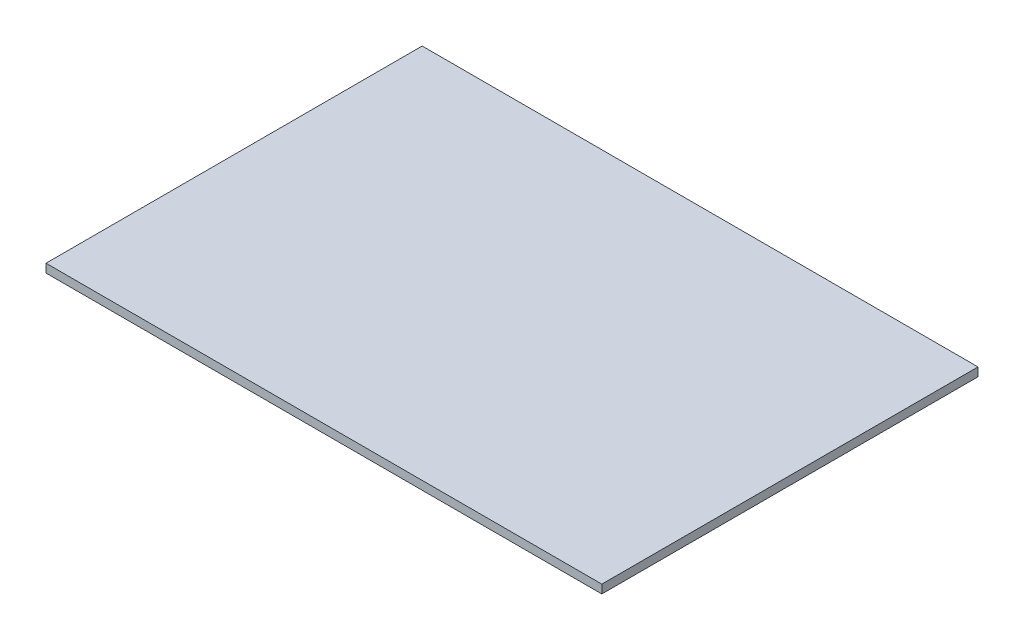
from build123d import *

# Parameters (mm, degrees)
SKETCH1_W           = 154.689230834
SKETCH1_H           = 104.69087676
BOSS_EXTRUDE1_DEPTH = 2.381745503


with BuildPart() as part:
    # Sketch1 → Boss-Extrude1 (new body)
    with BuildSketch(Plane(origin=(0, 0, 0), x_dir=(1, 0, 0), z_dir=(0, 1, 0))):
        with Locations((44.376268408, -30.685722728)):
            Rectangle(SKETCH1_W, SKETCH1_H)
    extrude(amount=BOSS_EXTRUDE1_DEPTH)


solid = part.part
